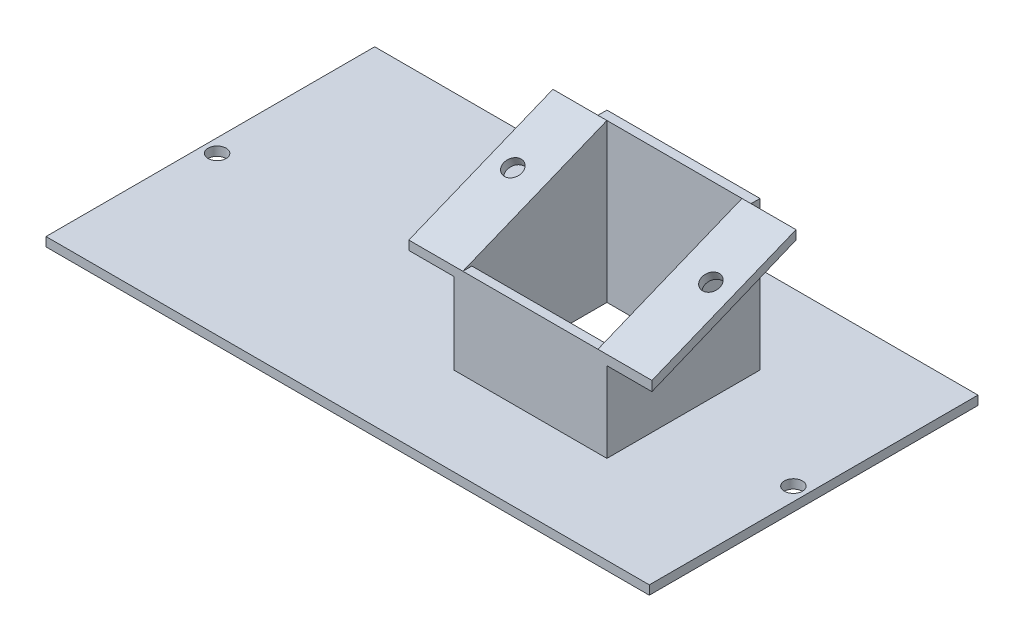
from build123d import *

# Parameters (mm, degrees)
SKETCH_1_W          = 134
SKETCH_1_H          = 73
SKETCH_1_R          = 2
SKETCH_1_W_2        = 30
SKETCH_1_H_2        = 30
EXTRUDE_1_DEPTH     = 2
SKETCH_2_W          = 34
SKETCH_2_H          = 34
SKETCH_2_W_2        = 30
SKETCH_2_H_2        = 30
EXTRUDE_2_DEPTH     = 20
SKETCH_3_W          = 34
SKETCH_3_H          = 2
EXTRUDE_4_DEPTH     = 13
EXTRUDE_5_DEPTH     = 2
EXTRUDE_6_DEPTH     = 2
EXTRUDE_8_DEPTH     = 10
EXTRUDE_9_DEPTH     = 10
SKETCH_9_R          = 2
CUT_EXTRUDE_1_DEPTH = 2


with BuildPart() as part:
    # 草图1 → 凸台-拉伸1 (new body)
    with BuildSketch(Plane(origin=(0, 0, 0), x_dir=(1, 0, 0), z_dir=(0, 1, 0))):
        with Locations((-9.171149658, 5.449528879)):
            Rectangle(SKETCH_1_W, SKETCH_1_H)
        with Locations(Location((-73.171149658, 3.949528879, 0), (0, 0, 270))):
            Circle(SKETCH_1_R, mode=Mode.SUBTRACT)
        with Locations(Location((54.828850342, 3.949528879, 0), (0, 0, 270))):
            Circle(SKETCH_1_R, mode=Mode.SUBTRACT)
        with Locations((11.799460463, 5.560834735)):
            Rectangle(SKETCH_1_W_2, SKETCH_1_H_2, mode=Mode.SUBTRACT)
    extrude(amount=EXTRUDE_1_DEPTH)

    # 草图2 → 凸台-拉伸2 (add)
    with BuildSketch(Plane(origin=(0, 2, 0), x_dir=(1, 0, 0), z_dir=(0, 1, 0))):
        with Locations((11.799460463, 5.560834735)):
            Rectangle(SKETCH_2_W, SKETCH_2_H)
        with Locations((11.799460463, 5.560834735)):
            Rectangle(SKETCH_2_W_2, SKETCH_2_H_2, mode=Mode.SUBTRACT)
    extrude(amount=EXTRUDE_2_DEPTH)

    # 草图3 → 凸台-拉伸4 (add)
    with BuildSketch(Plane(origin=(0, 22, 0), x_dir=(1, 0, 0), z_dir=(0, 1, 0))):
        with Locations((11.799460463, 21.560834735)):
            Rectangle(SKETCH_3_W, SKETCH_3_H)
    extrude(amount=EXTRUDE_4_DEPTH)

    # 草图5 → 凸台-拉伸5 (add)
    with BuildSketch(Plane(origin=(28.799460463, 0, 0), x_dir=(0, 0, -1), z_dir=(1, 0, 0))):
        Polygon((-11.439165265, 22), (20.560834735, 22), (20.560834735, 35), align=None)
    extrude(amount=-EXTRUDE_5_DEPTH)

    # 草图6 → 凸台-拉伸6 (add)
    with BuildSketch(Plane.ZY.offset(5.200539537)):
        Polygon((-20.560834735, 35), (-20.560834735, 22), (11.439165265, 22), align=None)
    extrude(amount=-EXTRUDE_6_DEPTH)

    # 草图8 → 凸台-拉伸8 (add)
    with BuildSketch(Plane.ZY.offset(5.200539537)):
        Polygon((11.439165265, 22), (11.439165265, 20.001570324), (-20.560834735, 32.989316021), (-20.560834735, 35), align=None)
    extrude(amount=EXTRUDE_8_DEPTH)

    # 草图7 → 凸台-拉伸9 (add)
    with BuildSketch(Plane(origin=(28.799460463, 0, 0), x_dir=(0, 0, -1), z_dir=(1, 0, 0))):
        Polygon((-11.439165265, 22), (20.560834735, 35), (20.560834735, 32.997882157), (-11.439165265, 19.836435038), align=None)
    extrude(amount=EXTRUDE_9_DEPTH)

    # 草图9 → 切除-拉伸1 (cut)
    with BuildSketch(Plane(origin=(0, 22.872332565, 9.291885105), x_dir=(1, 0, 0), z_dir=(0, 0.9264665771223091, 0.3763770469559383))):
        with Locations(Location((-10.200539537, 17.222122823, 0), (0, 0, 270))):
            Circle(SKETCH_9_R)
        with Locations(Location((33.799460463, 17.222122823, 0), (0, 0, 270))):
            Circle(SKETCH_9_R)
    extrude(amount=-CUT_EXTRUDE_1_DEPTH, mode=Mode.SUBTRACT)


solid = part.part
